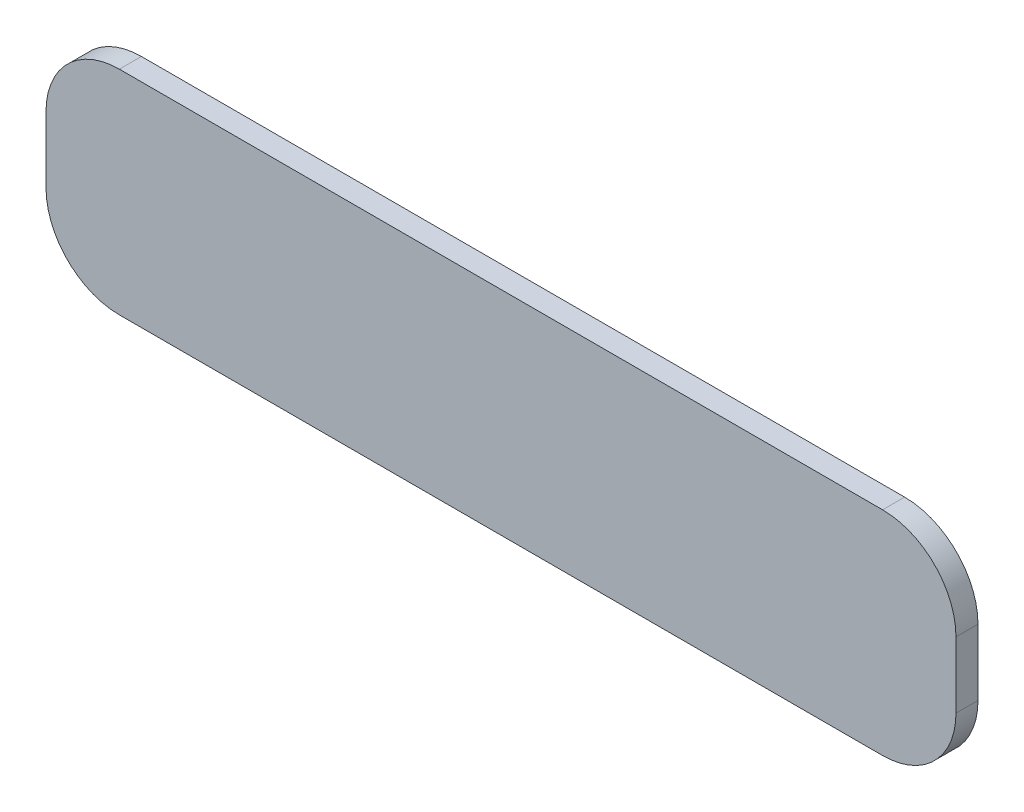
from build123d import *

# Parameters (mm, degrees)
CROQUIS1_W              = 124
CROQUIS1_H              = 29
SALIENTE_EXTRUIR1_DEPTH = 3
REDONDEO1_R             = 10


with BuildPart() as part:
    # Croquis1 → Saliente-Extruir1 (new body)
    with BuildSketch(Plane.XY):
        Rectangle(CROQUIS1_W, CROQUIS1_H)
    extrude(amount=SALIENTE_EXTRUIR1_DEPTH)

    # Redondeo1
    redondeo1_edges = [part.edges().sort_by_distance(p)[0] for p in [
        (-62, 14.5, 1.5),
        (62, 14.5, 1.5),
        (62, -14.5, 1.5),
        (-62, -14.5, 1.5),
    ]]
    fillet(redondeo1_edges, radius=REDONDEO1_R)


solid = part.part
